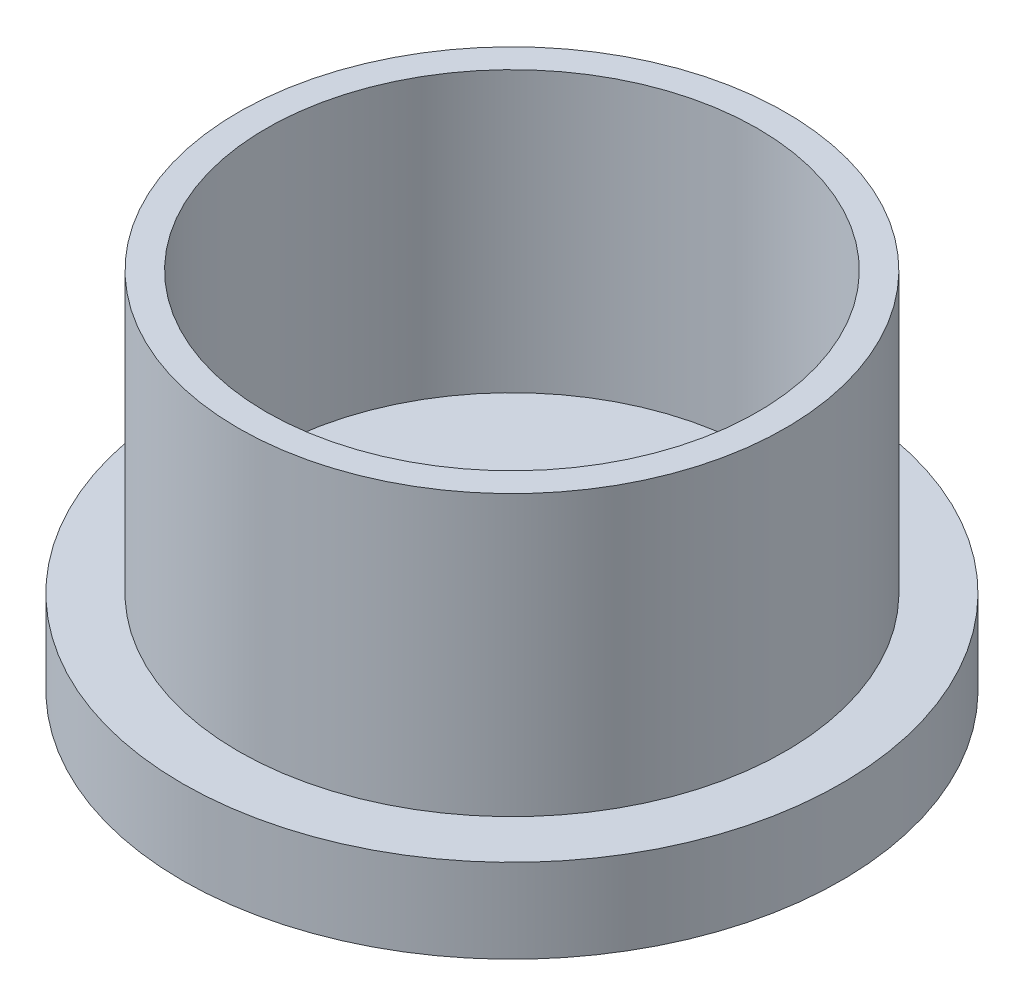
from build123d import *

# Parameters (mm, degrees)
SKETCH1_R           = 11.78
BOSS_EXTRUDE1_DEPTH = 3
SKETCH3_W           = 15.56
SKETCH3_H           = 1.5
CUT_EXTRUDE1_DEPTH  = 3
SKETCH4_W           = 1.5
SKETCH4_H           = 15.56
CUT_EXTRUDE2_DEPTH  = 3
SKETCH5_R           = 9.78
BOSS_EXTRUDE3_DEPTH = 10
SKETCH6_R           = 8.78
CUT_EXTRUDE3_DEPTH  = 10


with BuildPart() as part:
    # Sketch1 → Boss-Extrude1 (new body)
    with BuildSketch(Plane(origin=(0, 0, 0), x_dir=(1, 0, 0), z_dir=(0, 1, 0))):
        with Locations(Location((0, 0, 0), (0, 0, 270))):
            Circle(SKETCH1_R)
    extrude(amount=BOSS_EXTRUDE1_DEPTH)

    # Sketch3 → Cut-Extrude1 (cut)
    with BuildSketch(Plane(origin=(0, 3, 0), x_dir=(1, 0, 0), z_dir=(0, 1, 0))):
        Rectangle(SKETCH3_W, SKETCH3_H)
    extrude(amount=-CUT_EXTRUDE1_DEPTH, mode=Mode.SUBTRACT)

    # Sketch4 → Cut-Extrude2 (cut)
    with BuildSketch(Plane(origin=(0, 3, 0), x_dir=(1, 0, 0), z_dir=(0, 1, 0))):
        Rectangle(SKETCH4_W, SKETCH4_H)
    extrude(amount=-CUT_EXTRUDE2_DEPTH, mode=Mode.SUBTRACT)

    # Sketch5 → Boss-Extrude3 (add)
    with BuildSketch(Plane(origin=(0, 3, 0), x_dir=(1, 0, 0), z_dir=(0, 1, 0))):
        with Locations(Location((0, 0, 0), (0, 0, 270))):
            Circle(SKETCH5_R)
    extrude(amount=BOSS_EXTRUDE3_DEPTH)

    # Sketch6 → Cut-Extrude3 (cut)
    with BuildSketch(Plane(origin=(0, 13, 0), x_dir=(1, 0, 0), z_dir=(0, 1, 0))):
        with Locations(Location((0, 0, 0), (0, 0, 270))):
            Circle(SKETCH6_R)
    extrude(amount=-CUT_EXTRUDE3_DEPTH, mode=Mode.SUBTRACT)


solid = part.part
